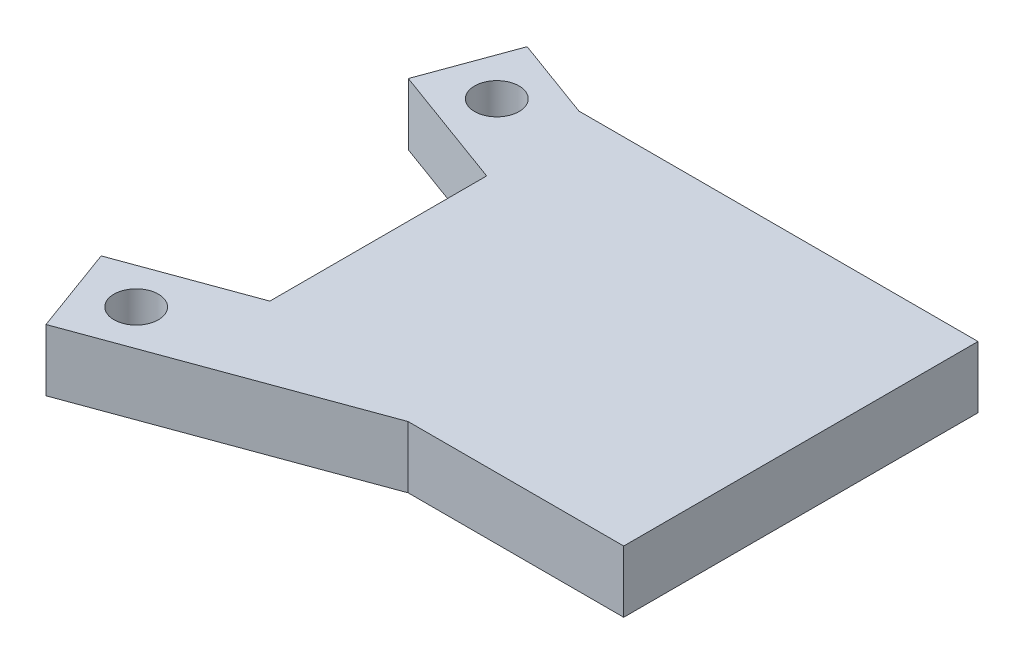
from build123d import *

# Parameters (mm, degrees)
BOSS_EXTRUDE1_DEPTH = 6.35
SKETCH2_R           = 2.286
CUT_EXTRUDE1_DEPTH  = 101.585266767


with BuildPart() as part:
    # Sketch1 → Boss-Extrude1 (new body)
    with BuildSketch(Plane(origin=(0, 0, 0), x_dir=(1, 0, 0), z_dir=(0, 1, 0))):
        Polygon((21.229343583, -21.824581583), (29.62595728, -24.897159466), (70.66112252, -24.897159466), (70.66112252, -61.327405263), (48.489495365, -61.327405263), (21.229343583, -71.302728943), (17.95612252, -62.357805865), (30.65612252, -57.710487253), (30.65612252, -35.416823273), (17.95612252, -30.769504661), align=None)
    extrude(amount=BOSS_EXTRUDE1_DEPTH)

    # Sketch2 → Cut-Extrude1 (cut, through all)
    with BuildSketch(Plane(origin=(0, 6.35, 0), x_dir=(1, 0, 0), z_dir=(0, 1, 0))):
        with Locations(Location((24.30612252, -65.105493971, 0), (0, 0, 270))):
            Circle(SKETCH2_R)
        with Locations(Location((24.30612252, -28.021816555, 0), (0, 0, 270))):
            Circle(SKETCH2_R)
    extrude(amount=-CUT_EXTRUDE1_DEPTH, mode=Mode.SUBTRACT)


solid = part.part
